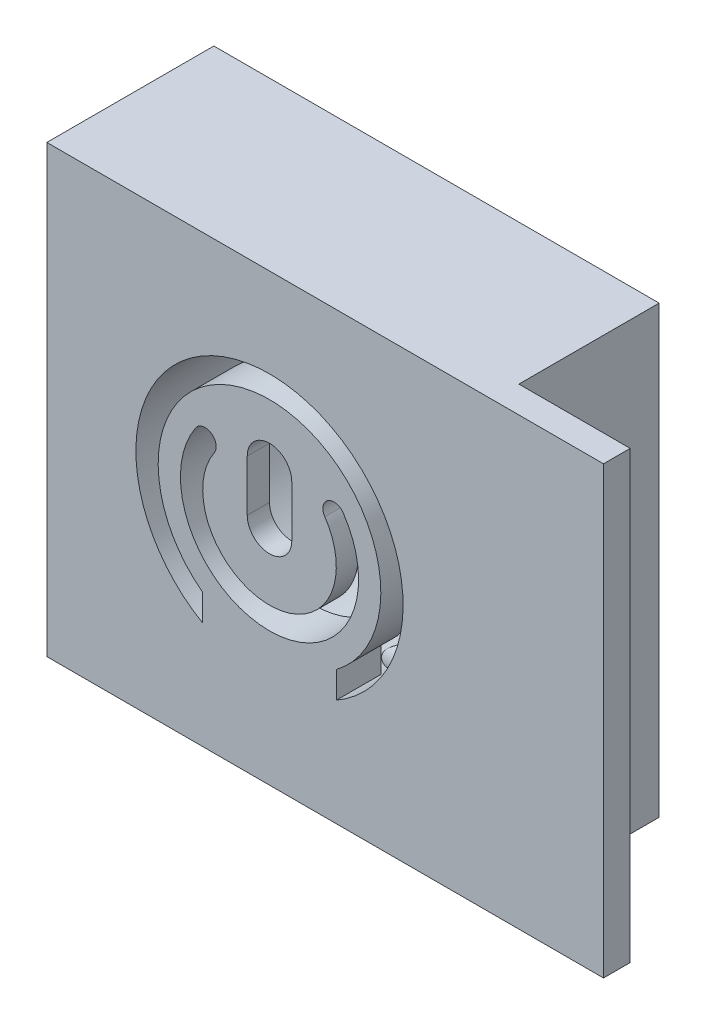
from build123d import *
from build123d.topology import SkipClean

# Parameters (mm, degrees)
SKETCH1_W               = 20
SKETCH1_H               = 20
BOSS_EXTRUDE1_DEPTH     = 7.5
SKETCH2_R               = 6
CUT_EXTRUDE1_DEPTH      = 5.5
CUT_EXTRUDE2_DEPTH      = 5
SKETCH4_R               = 4
CUT_EXTRUDE3_DEPTH      = 1
CUT_EXTRUDE4_REACH      = 18.008
SKETCH6_W               = 2
SKETCH6_H               = 5.5
SKETCH6_W_2             = 5.5
SKETCH6_H_2             = 2
CUT_EXTRUDE5_DEPTH      = 7
CUT_EXTRUDE6_REACH      = 25.585
SKETCH7_R               = 1.5
CUT_EXTRUDE7_REACH      = 25.585
SKETCH8_R               = 1.5
CUT_EXTRUDE8_REACH      = 25.585
CUT_EXTRUDE8_END_RADIUS = 6
SKETCH9_R               = 1.8
SKETCH10_W              = 1.2
SKETCH10_H              = 20
BOSS_EXTRUDE2_DEPTH     = 5
SKETCH11_R              = 0.5
BOSS_EXTRUDE3_DEPTH     = 2
CUT_EXTRUDE9_REACH      = 21.526
SKETCH12_W              = 6.66
SKETCH12_H              = 4.15
SKETCH13_W              = 10.66
SKETCH13_H              = 8.15
SKETCH13_W_2            = 6.66
SKETCH13_H_2            = 4.15
BOSS_EXTRUDE4_DEPTH     = 2.5


with BuildPart() as part:
    # Sketch1 → Boss-Extrude1 (new body)
    with BuildSketch(Plane.XY):
        Rectangle(SKETCH1_W, SKETCH1_H)
    extrude(amount=BOSS_EXTRUDE1_DEPTH)

    # Sketch2 → Cut-Extrude1 (cut)
    with BuildSketch(Plane(origin=(0, 0, 0), x_dir=(-1, 0, 0), z_dir=(0, 0, -1))):
        Circle(SKETCH2_R)
    extrude(amount=-CUT_EXTRUDE1_DEPTH, mode=Mode.SUBTRACT)

    # Sketch3 → Cut-Extrude2 (cut)
    with BuildSketch(Plane(origin=(0, 0, 5.5), x_dir=(-1, 0, 0), z_dir=(0, 0, -1))):
        with BuildLine():
            Line((-3, -5.196152423), (-3, -4))
            ThreePointArc((-3, -4), (-4.74341649, 1.58113883), (0, 5))
            Line((0, 5), (0, 6))
            ThreePointArc((0, 6), (-5.795554958, 1.552914271), (-3, -5.196152423))
        make_face()
        with BuildLine():
            Line((0, 6), (0, 5))
            ThreePointArc((0, 5), (3.535533906, 3.535533906), (5, 0))
            ThreePointArc((5, 0), (4.472135955, -2.236067977), (3, -4))
            Line((3, -4), (3, -5.196152423))
            ThreePointArc((3, -5.196152423), (5.196152423, -3), (6, 0))
            ThreePointArc((6, 0), (4.242640687, 4.242640687), (0, 6))
        make_face()
    extrude(amount=-CUT_EXTRUDE2_DEPTH, mode=Mode.SUBTRACT)

    # Sketch4 → Cut-Extrude3 (cut)
    with BuildSketch(Plane(origin=(0, 0, 5.5), x_dir=(-1, 0, 0), z_dir=(0, 0, -1))):
        Circle(SKETCH4_R)
    extrude(amount=-CUT_EXTRUDE3_DEPTH, mode=Mode.SUBTRACT)

    # Sketch5 → Cut-Extrude4 (cut, up to next)
    with BuildSketch(Plane.XY.offset(7.5), mode=Mode.PRIVATE) as cut_extrude4_sk1:
        with BuildLine():
            Line((-1, 2.3), (-1, 0))
            ThreePointArc((-1, 0), (0, -1), (1, 0))
            Line((1, 0), (1, 2.3))
            ThreePointArc((1, 2.3), (0, 3.3), (-1, 2.3))
        make_face()
    cut_extrude4_tool1 = extrude(cut_extrude4_sk1.sketch, amount=-CUT_EXTRUDE4_REACH, mode=Mode.PRIVATE) & part.part
    # Sketch5 → Cut-Extrude4 (cut, up to next)
    with BuildSketch(Plane.XY.offset(7.5), mode=Mode.PRIVATE) as cut_extrude4_sk2:
        with BuildLine():
            ThreePointArc((-2.482774923, 1.683991889), (0, -3), (2.482774923, 1.683991889))
            ThreePointArc((2.482774923, 1.683991889), (2.615905429, 2.378453024), (3.310366564, 2.245322518))
            ThreePointArc((3.310366564, 2.245322518), (0, -4), (-3.310366564, 2.245322518))
            ThreePointArc((-3.310366564, 2.245322518), (-2.615905429, 2.378453024), (-2.482774923, 1.683991889))
        make_face()
    cut_extrude4_tool2 = extrude(cut_extrude4_sk2.sketch, amount=-CUT_EXTRUDE4_REACH, mode=Mode.PRIVATE) & part.part
    add(cut_extrude4_tool1.solids().sort_by_distance((0, 1.15, 7.5))[0], mode=Mode.SUBTRACT)
    add(cut_extrude4_tool2.solids().sort_by_distance((2.673641, 2.293331, 7.5))[0], mode=Mode.SUBTRACT)

    # Sketch6 → Cut-Extrude5 (cut)
    with SkipClean():  # the faces are left unmerged after this step: merging them gives an invalid solid
        with BuildSketch(Plane(origin=(0, 0, 0), x_dir=(-1, 0, 0), z_dir=(0, 0, -1))):
            with Locations((7.5, 0)):
                Rectangle(SKETCH6_W, SKETCH6_H)
            with Locations((0, -7.5)):
                Rectangle(SKETCH6_W_2, SKETCH6_H_2)
        extrude(amount=-CUT_EXTRUDE5_DEPTH, mode=Mode.SUBTRACT)

    # Sketch7 → Cut-Extrude6 (cut, up to next)
    with BuildSketch(Plane.ZY.offset(10), mode=Mode.PRIVATE) as cut_extrude6_sk1:
        with Locations(Location((3.75, 0, 0), (0, 0, 270))):
            Circle(SKETCH7_R)
    cut_extrude6_tool1 = extrude(cut_extrude6_sk1.sketch, amount=-CUT_EXTRUDE6_REACH, mode=Mode.PRIVATE) & part.part
    add(cut_extrude6_tool1.solids().sort_by_distance((-10, 0, 3.75))[0], mode=Mode.SUBTRACT)

    # Sketch8 → Cut-Extrude7 (cut, up to next)
    with BuildSketch(Plane(origin=(0, -10, 0), x_dir=(-1, 0, 0), z_dir=(0, -1, 0)), mode=Mode.PRIVATE) as cut_extrude7_sk1:
        with Locations(Location((0, -3.75, 0), (0, 0, 90))):
            Circle(SKETCH8_R)
    cut_extrude7_tool1 = extrude(cut_extrude7_sk1.sketch, amount=-CUT_EXTRUDE7_REACH, mode=Mode.PRIVATE) & part.part
    add(cut_extrude7_tool1.solids().sort_by_distance((0, -10, 3.75))[0], mode=Mode.SUBTRACT)

    # Cut-Extrude8: up to this cylinder (the profile starts outside it)
    with SkipClean():  # the faces are left unmerged after this step: merging them gives an invalid solid
        cut_extrude8_end = Plane(origin=(0, 0, 3.75), z_dir=(0, 0, -1)) * Cylinder(CUT_EXTRUDE8_END_RADIUS, 64.17, mode=Mode.PRIVATE)
        # Sketch9 → Cut-Extrude8 (cut, up to the surface)
        with BuildSketch(Plane(origin=(10, 0, 0), x_dir=(0, 0, -1), z_dir=(1, 0, 0)), mode=Mode.PRIVATE) as cut_extrude8_sk1:
            with Locations(Location((-3.75, 4, 0), (0, 0, 90))):
                Circle(SKETCH9_R)
        cut_extrude8_tool1 = extrude(cut_extrude8_sk1.sketch, amount=-CUT_EXTRUDE8_REACH, mode=Mode.PRIVATE) - cut_extrude8_end
        add(cut_extrude8_tool1.solids().sort_by_distance((10, 4, 3.75))[0], mode=Mode.SUBTRACT)
        # Sketch9 → Cut-Extrude8 (cut, up to the surface)
        with BuildSketch(Plane(origin=(10, 0, 0), x_dir=(0, 0, -1), z_dir=(1, 0, 0)), mode=Mode.PRIVATE) as cut_extrude8_sk2:
            with Locations(Location((-3.75, -4, 0), (0, 0, 90))):
                Circle(SKETCH9_R)
        cut_extrude8_tool2 = extrude(cut_extrude8_sk2.sketch, amount=-CUT_EXTRUDE8_REACH, mode=Mode.PRIVATE) - cut_extrude8_end
        add(cut_extrude8_tool2.solids().sort_by_distance((10, -4, 3.75))[0], mode=Mode.SUBTRACT)

    # Sketch10 → Boss-Extrude2 (add)
    with SkipClean():  # the faces are left unmerged after this step: merging them gives an invalid solid
        with BuildSketch(Plane(origin=(10, 0, 0), x_dir=(0, 0, -1), z_dir=(1, 0, 0))):
            with Locations((-6.9, 0)):
                Rectangle(SKETCH10_W, SKETCH10_H)
        extrude(amount=BOSS_EXTRUDE2_DEPTH)

    # Sketch11 → Boss-Extrude3 (add)
    with SkipClean():  # the faces are left unmerged after this step: merging them gives an invalid solid
        with BuildSketch(Plane(origin=(0, 0, 5.5), x_dir=(-1, 0, 0), z_dir=(0, 0, -1))):
            with Locations(Location((0, 4.5, 0), (0, 0, 269.99891962))):
                Circle(SKETCH11_R)
        extrude(amount=BOSS_EXTRUDE3_DEPTH)

    # Cut-Extrude9: up to this face of the body (flat: up to its plane)
    cut_extrude9_end = Plane(part.part.faces().sort_by_distance((0, 4.5, 3.5))[0])
    # Sketch12 → Cut-Extrude9 (cut, up to the picked face)
    with BuildSketch(Plane(origin=(0, 0, 0), x_dir=(-1, 0, 0), z_dir=(0, 0, -1)), mode=Mode.PRIVATE) as cut_extrude9_sk1:
        with Locations((0, 4.5)):
            Rectangle(SKETCH12_W, SKETCH12_H)
    cut_extrude9_tool1 = split(extrude(cut_extrude9_sk1.sketch, amount=-CUT_EXTRUDE9_REACH, mode=Mode.PRIVATE), bisect_by=cut_extrude9_end, keep=Keep.BOTH, mode=Mode.PRIVATE)
    add(cut_extrude9_tool1.solids().sort_by(Axis((0, 4.5, 0), (0, 0, 1)))[0], mode=Mode.SUBTRACT)

    # Sketch13 → Boss-Extrude4 (add)
    with SkipClean():  # the faces are left unmerged after this step: merging them gives an invalid solid
        with BuildSketch(Plane(origin=(0, 0, 0), x_dir=(-1, 0, 0), z_dir=(0, 0, -1))):
            with Locations((0, 4.5)):
                Rectangle(SKETCH13_W, SKETCH13_H)
            with Locations((0, 4.5)):
                Rectangle(SKETCH13_W_2, SKETCH13_H_2, mode=Mode.SUBTRACT)
        extrude(amount=-BOSS_EXTRUDE4_DEPTH)


solid = part.part
